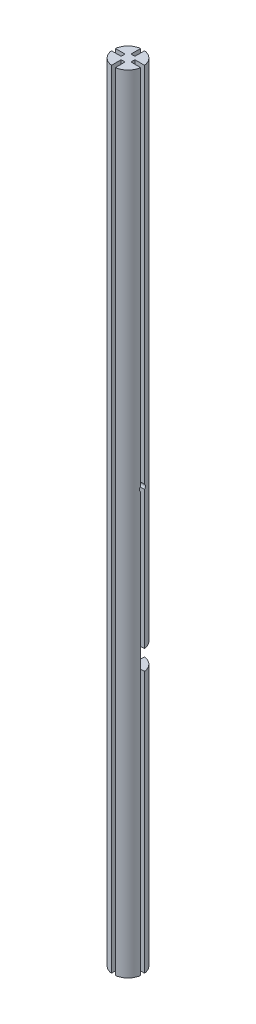
from build123d import *

# Parameters (mm, degrees)
BOSS_EXTRUDE2_DEPTH = 4000
CUT_EXTRUDE2_START  = 1380
SKETCH2_W           = 150.702712824
SKETCH2_H           = 74.330343737
CUT_EXTRUDE2_DEPTH  = 50
SKETCH3_R           = 15.2
CUT_EXTRUDE3_DEPTH  = 4004.451635776


with BuildPart() as part:
    # Sketch1 → Boss-Extrude2 (new body)
    with BuildSketch(Plane(origin=(0, 0, 0), x_dir=(1, 0, 0), z_dir=(0, 1, 0))):
        with BuildLine():
            Line((-10, 74.330343737), (-10, 25))
            Line((-10, 25), (10, 25))
            Line((10, 25), (10, 74.330343737))
            ThreePointArc((10, 74.330343737), (53.033008589, 53.033008589), (74.330343737, 10))
            Line((74.330343737, 10), (25, 10))
            Line((25, 10), (25, -10))
            Line((25, -10), (74.330343737, -10))
            ThreePointArc((74.330343737, -10), (53.033008589, -53.033008589), (10, -74.330343737))
            Line((10, -74.330343737), (10, -25))
            Line((10, -25), (-10, -25))
            Line((-10, -25), (-10, -74.330343737))
            ThreePointArc((-10, -74.330343737), (-53.033008589, -53.033008589), (-74.330343737, -10))
            Line((-74.330343737, -10), (-25, -10))
            Line((-25, -10), (-25, 10))
            Line((-25, 10), (-74.330343737, 10))
            ThreePointArc((-74.330343737, 10), (-53.033008589, 53.033008589), (-10, 74.330343737))
        make_face()
    extrude(amount=BOSS_EXTRUDE2_DEPTH)

    # Sketch2 → Cut-Extrude2 (cut, symmetric)
    with BuildSketch(Plane(origin=(0, 0, 0), x_dir=(1, 0, 0), z_dir=(0, 1, 0)).offset(CUT_EXTRUDE2_START)):
        with Locations((-1.021012675, 37.165171869)):
            Rectangle(SKETCH2_W, SKETCH2_H)
    extrude(amount=CUT_EXTRUDE2_DEPTH, both=True, mode=Mode.SUBTRACT)

    # Sketch3 → Cut-Extrude3 (cut, through all)
    with BuildSketch(Plane(origin=(74.330343737, 0, 0), x_dir=(0, 0, -1), z_dir=(1, 0, 0))):
        with Locations(Location((0, 2143, 0), (0, 0, 48.860489585))):
            Circle(SKETCH3_R)
    extrude(amount=-CUT_EXTRUDE3_DEPTH, mode=Mode.SUBTRACT)


solid = part.part
